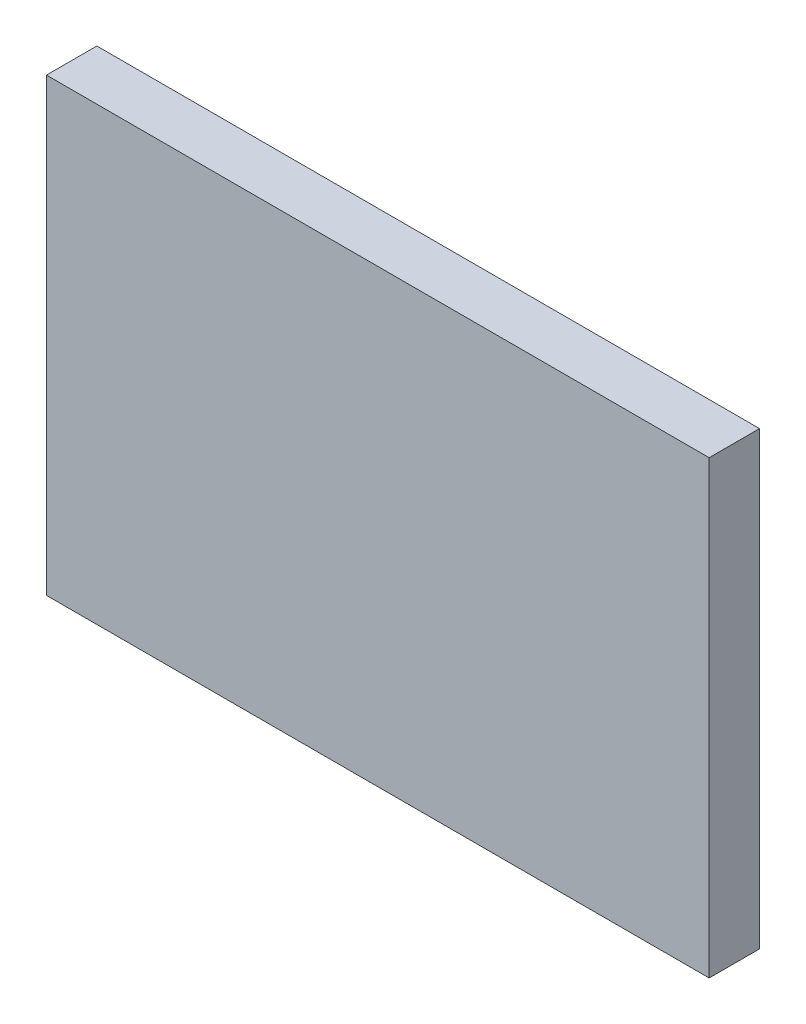
from build123d import *

# Parameters (mm, degrees)
SKETCH_1_W      = 45
SKETCH_1_H      = 34
EXTRUDE_1_DEPTH = 3.8
SKETCH_3_W      = 5
SKETCH_3_H      = 34
EXTRUDE_5_DEPTH = 3.8


with BuildPart() as part:
    # Эскиз1 → Бобышка-Вытянуть1 (new body)
    with BuildSketch(Plane.XY):
        with Locations((22.5, -17)):
            Rectangle(SKETCH_1_W, SKETCH_1_H)
    extrude(amount=EXTRUDE_1_DEPTH)

    # Эскиз3 → Бобышка-Вытянуть5 (add)
    with BuildSketch(Plane.XY):
        with Locations((47.5, -17)):
            Rectangle(SKETCH_3_W, SKETCH_3_H)
    extrude(amount=EXTRUDE_5_DEPTH)


solid = part.part
